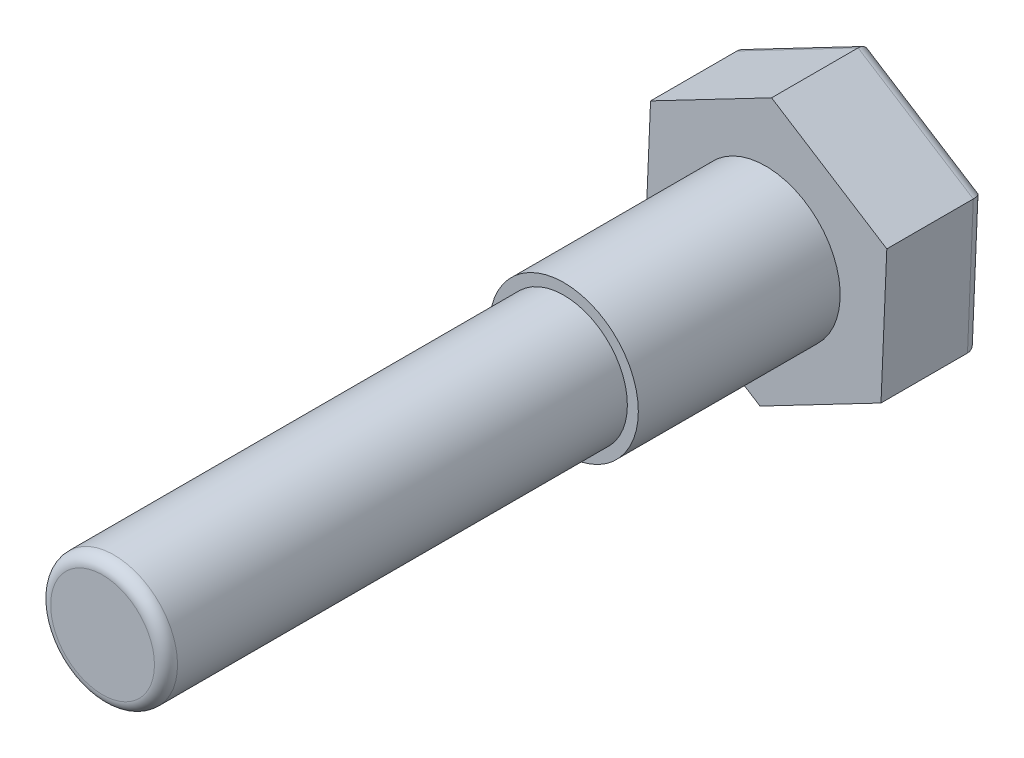
from build123d import *

# Parameters (mm, degrees)
EXTRUDE_303_DEPTH = 17
SKETCH_2_R        = 12.9
EXTRUDE_1_DEPTH   = 35
FILLET_3_R        = 2
SKETCH_3_R        = 11
EXTRUDE_2_DEPTH   = 80
FILLET_4_R        = 2


with BuildPart() as part:
    # 草图1 → Extrude 303 (new body)
    with BuildSketch(Plane.XY):
        Polygon((20.984201837, 10.954296262), (1.005402075, 23.65), (-19.978799762, 12.695703738), (-20.984201837, -10.954296262), (-1.005402075, -23.65), (19.978799762, -12.695703738), align=None)
    extrude(amount=EXTRUDE_303_DEPTH)

    # 草图2 → 凸台-拉伸1 (add)
    with BuildSketch(Plane.XY.offset(17)):
        with Locations(Location((0, 0, 0), (0, 0, 180))):
            Circle(SKETCH_2_R)
    extrude(amount=EXTRUDE_1_DEPTH)

    # 圆角3
    fillet_3_edges = [part.edges().sort_by_distance(p)[0] for p in [
        (9.486698843, -18.172851869, 0),
        (-10.994801956, -17.302148131, 0),
        (-20.4815008, 0.870703738, 0),
        (-9.486698843, 18.172851869, 0),
        (10.994801956, 17.302148131, 0),
        (20.4815008, -0.870703738, 0),
    ]]
    fillet(fillet_3_edges, radius=FILLET_3_R)

    # 草图3 → 凸台-拉伸2 (add)
    with BuildSketch(Plane.XY.offset(52)):
        Circle(SKETCH_3_R)
    extrude(amount=EXTRUDE_2_DEPTH)

    # 圆角4
    fillet_4_edges = [part.edges().sort_by_distance(p)[0] for p in [
        (-11, 0, 132),
    ]]
    fillet(fillet_4_edges, radius=FILLET_4_R)


solid = part.part
